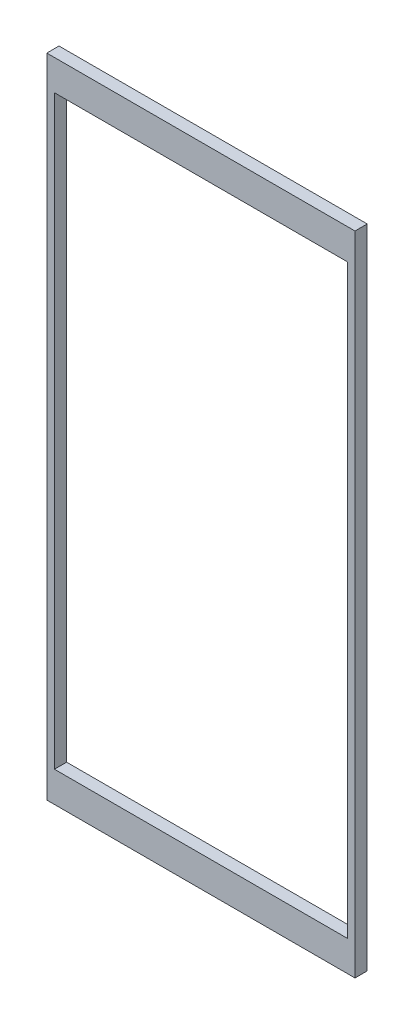
from build123d import *

# Parameters (mm, degrees)
SKETCH1_W           = 202
SKETCH1_H           = 424
BOSS_EXTRUDE1_DEPTH = 8
SKETCH2_W           = 192
SKETCH2_H           = 384
CUT_EXTRUDE1_DEPTH  = 470.727580625
SKETCH4_R           = 2
CUT_EXTRUDE2_DEPTH  = 4.78


with BuildPart() as part:
    # Sketch1 → Boss-Extrude1 (new body)
    with BuildSketch(Plane.XY):
        with Locations((101, 212)):
            Rectangle(SKETCH1_W, SKETCH1_H)
    extrude(amount=BOSS_EXTRUDE1_DEPTH)

    # Sketch2 → Cut-Extrude1 (cut, through all)
    with BuildSketch(Plane(origin=(0, 0, 0), x_dir=(-1, 0, 0), z_dir=(0, 0, -1))):
        with Locations((-101, 212)):
            Rectangle(SKETCH2_W, SKETCH2_H)
    extrude(amount=-CUT_EXTRUDE1_DEPTH, mode=Mode.SUBTRACT)

    # Sketch4 → Cut-Extrude2 (cut)
    with BuildSketch(Plane(origin=(0, 0, 0), x_dir=(-1, 0, 0), z_dir=(0, 0, -1))):
        with Locations((-184, 414)):
            Circle(SKETCH4_R)
        with Locations((-18, 414)):
            Circle(SKETCH4_R)
        with Locations((-101, 414)):
            Circle(SKETCH4_R)
    cut_extrude2 = extrude(amount=-CUT_EXTRUDE2_DEPTH, mode=Mode.SUBTRACT)

    # Mirror1: Cut-Extrude2 across plane
    add(cut_extrude2.mirror(Plane.ZX.offset(212)), mode=Mode.SUBTRACT)


solid = part.part
